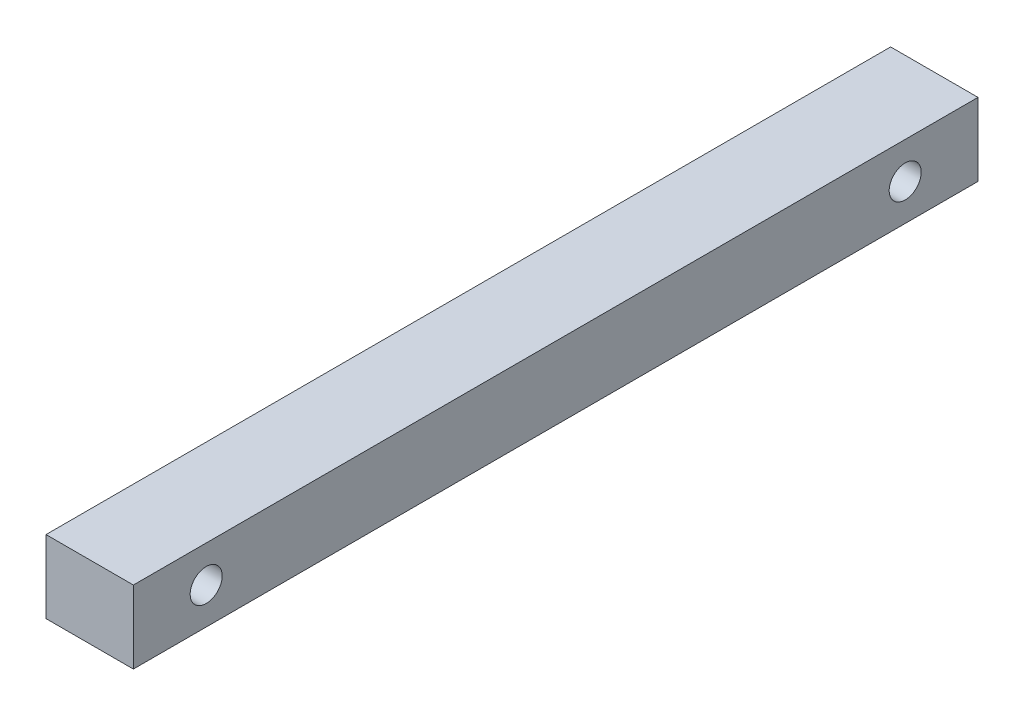
from build123d import *

# Parameters (mm, degrees)
ESBO_O1_W                = 30
ESBO_O1_H                = 25
RESSALTO_EXTRUS_O2_DEPTH = 290
ESBO_O2_R                = 5.5
CORTE_EXTRUS_O1_DEPTH    = 290


with BuildPart() as part:
    # Esboço1 → Ressalto-extrusão2 (new body)
    with BuildSketch(Plane.XY):
        Rectangle(ESBO_O1_W, ESBO_O1_H)
    extrude(amount=RESSALTO_EXTRUS_O2_DEPTH)

    # Esboço2 → Corte-extrusão1 (cut)
    with BuildSketch(Plane.ZY.offset(15)):
        with Locations((25, 0)):
            Circle(ESBO_O2_R)
        with Locations((265, 0)):
            Circle(ESBO_O2_R)
    extrude(amount=-CORTE_EXTRUS_O1_DEPTH, mode=Mode.SUBTRACT)


solid = part.part
